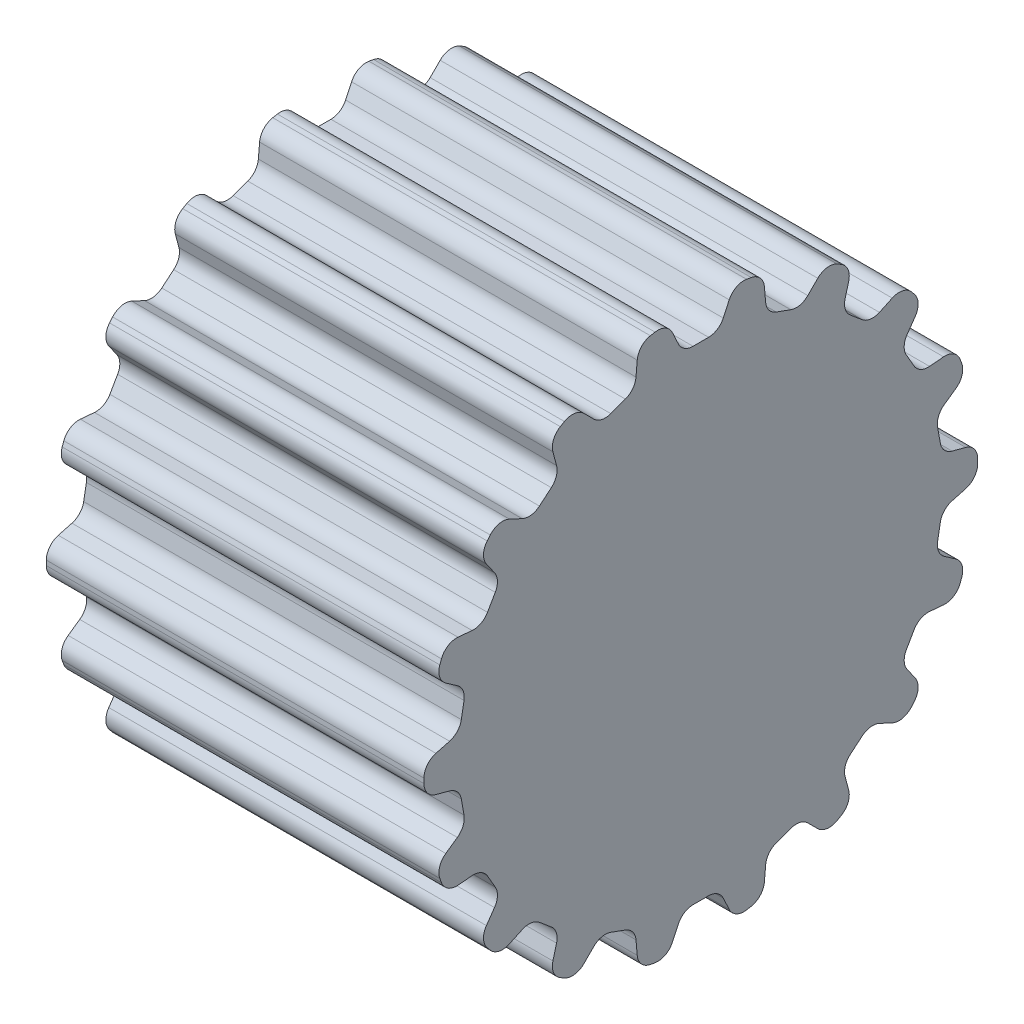
from build123d import *

# Parameters (mm, degrees)
BOSS_EXTRUDE1_DEPTH = 7
CIRPATTERN1_COUNT   = 18


with BuildPart() as part:
    # Sketch1 → Boss-Extrude1 (new body)
    with BuildSketch(Plane(origin=(0, 0, 0), x_dir=(0, 0, -1), z_dir=(1, 0, 0))):
        with BuildLine():
            Line((-0.526373096, 4.893111283), (-0.415771258, 4.655924876))
            ThreePointArc((-0.415771258, 4.655924876), (-0.305068804, 4.529692921), (-0.143878922, 4.482710354))
            Line((-0.143878922, 4.482710354), (0.143878922, 4.482710354))
            ThreePointArc((0.143878922, 4.482710354), (0.305068804, 4.529692921), (0.415771258, 4.655924876))
            Line((0.415771258, 4.655924876), (0.526373096, 4.893111283))
            ThreePointArc((0.526373096, 4.893111283), (0.658598849, 5.031831446), (0.847819328, 5.062204853))
            ThreePointArc((0.847819328, 5.062204853), (0.86956059, 5.058515589), (0.8912858, 5.054732951))
            Line((0.8912858, 5.054732951), (0, 0))
            Line((0, 0), (-0.8912858, 5.054732951))
            ThreePointArc((-0.8912858, 5.054732951), (-0.86956059, 5.058515589), (-0.847819328, 5.062204853))
            ThreePointArc((-0.847819328, 5.062204853), (-0.658598849, 5.031831446), (-0.526373096, 4.893111283))
        make_face()
    extrude(amount=BOSS_EXTRUDE1_DEPTH)

    # CirPattern1: part ×18 about axis
    cirpattern1_axis = Axis((0, 0, 0), (1, 0, 0))


with BuildPart() as part_1:
    add(part.part)
    for i in range(1, CIRPATTERN1_COUNT):
        add(part.part.rotate(cirpattern1_axis, i * 360 / CIRPATTERN1_COUNT))


solid = part_1.part
